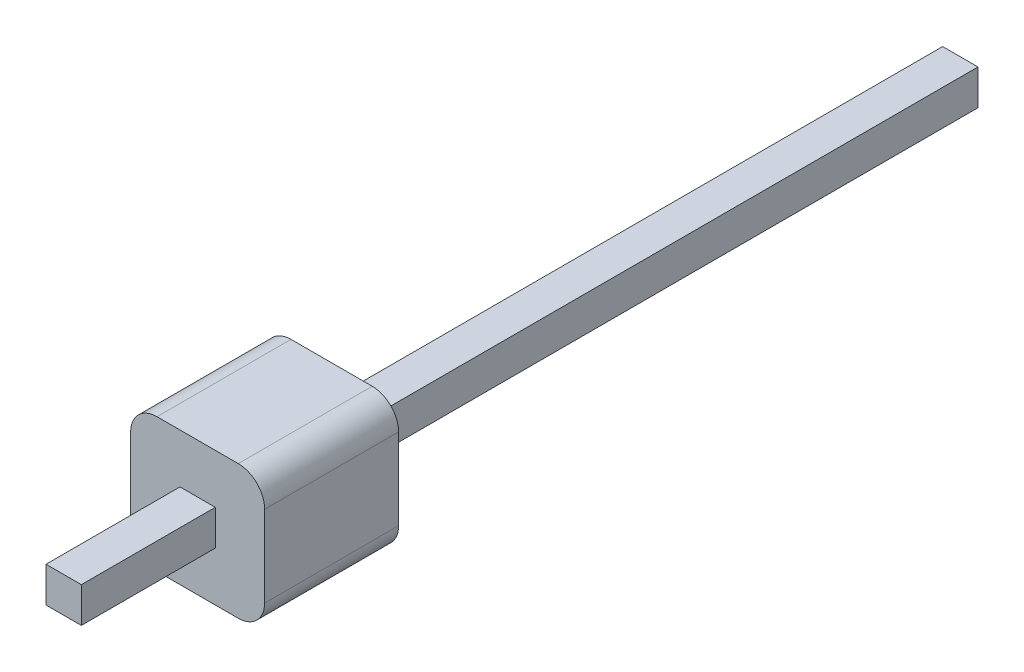
from build123d import *

# Parameters (mm, degrees)
SKETCH_1_W      = 2.54
SKETCH_1_H      = 2.54
EXTRUDE_1_DEPTH = 2.54
SKETCH_2_W      = 0.67
SKETCH_2_H      = 0.67
FILLET_1_R      = 0.5


with BuildPart() as part:
    # 草图1 → 拉伸1 (new body)
    with BuildSketch(Plane.XY):
        Rectangle(SKETCH_1_W, SKETCH_1_H)
    extrude(amount=EXTRUDE_1_DEPTH)

    # 扫描1: sweep along a path in 草图3
    with BuildLine(Plane(origin=(0, 0, 0), x_dir=(0, 0, -1), z_dir=(1, 0, 0))) as sweep_1_path:
        Line((11.92, -0.01), (-5.08, -0.01))
    # 草图2 → 扫描1 (sweep)
    with BuildSketch(Plane(origin=(0, 0, 5.08), x_dir=(-1, 0, 0), z_dir=(0, 0, -1))):
        Rectangle(SKETCH_2_W, SKETCH_2_H)
    sweep(path=sweep_1_path.line)

    # 圆角1
    fillet_1_edges = [part.edges().sort_by_distance(p)[0] for p in [
        (-1.27, 1.27, 1.27),
        (1.27, 1.27, 1.27),
        (1.27, -1.27, 1.27),
        (-1.27, -1.27, 1.27),
    ]]
    fillet(fillet_1_edges, radius=FILLET_1_R)


solid = part.part
